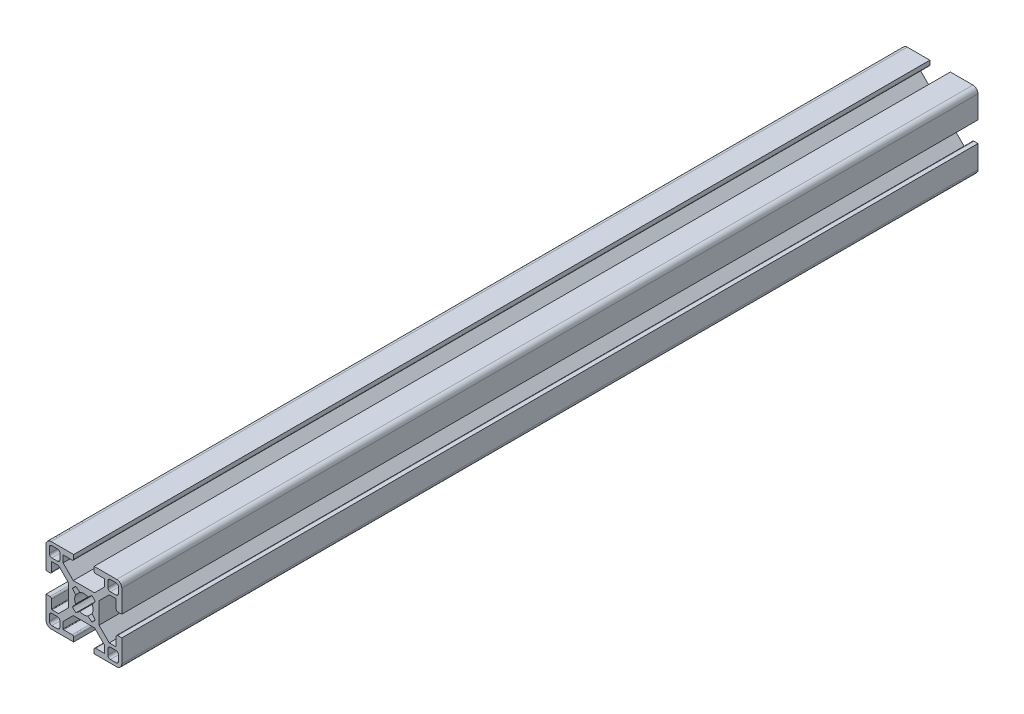
from build123d import *

# Parameters (mm, degrees)
BOSCH_REXROTH_DIMENSION_30_8MM_SLOTS_3_DEPTH = 339


with BuildPart() as part:
    # Sketch1 → Bosch rexroth dimension 30 (8mm slots) 30X30(7) (new body)
    with BuildSketch(Plane(origin=(0, 15, 339), x_dir=(1, 0, 0), z_dir=(0, 0, -1))):
        with BuildLine():
            Line((6.00446543, 4.204465866), (6.00446543, -4.204465866))
            Line((6.00446543, -4.204465866), (10.049999564, -8.25))
            Line((10.049999564, -8.25), (12.59999928, -8.25))
            ThreePointArc((12.59999928, -8.25), (12.741420837, -8.191421273), (12.799999564, -8.049999716))
            Line((12.799999564, -8.049999716), (12.799999564, -4.649999613))
            ThreePointArc((12.799999564, -4.649999613), (12.975735606, -4.225735278), (13.39999994, -4.049999237))
            Line((13.39999994, -4.049999237), (15, -4.049999237))
            Line((15, -4.049999237), (15, -13.000000346))
            ThreePointArc((15, -13.000000346), (14.414213664, -14.414213664), (13.000000346, -15))
            Line((13.000000346, -15), (4.05, -15))
            Line((4.05, -15), (4.05, -13.399999434))
            ThreePointArc((4.05, -13.399999434), (4.225735989, -12.975735226), (4.650000197, -12.799999237))
            Line((4.650000197, -12.799999237), (8.049999924, -12.799999237))
            ThreePointArc((8.049999924, -12.799999237), (8.191421565, -12.741420475), (8.250000327, -12.599998834))
            Line((8.250000327, -12.599998834), (8.250000327, -10.049999237))
            Line((8.250000327, -10.049999237), (4.204466193, -6))
            Line((4.204466193, -6), (-4.204466193, -6))
            Line((-4.204466193, -6), (-8.250000327, -10.049999237))
            Line((-8.250000327, -10.049999237), (-8.250000327, -12.599998834))
            ThreePointArc((-8.250000327, -12.599998834), (-8.191421565, -12.741420475), (-8.049999924, -12.799999237))
            Line((-8.049999924, -12.799999237), (-4.650000197, -12.799999237))
            ThreePointArc((-4.650000197, -12.799999237), (-4.225735989, -12.975735226), (-4.05, -13.399999434))
            Line((-4.05, -13.399999434), (-4.05, -15))
            Line((-4.05, -15), (-13.000000346, -15))
            ThreePointArc((-13.000000346, -15), (-14.414213664, -14.414213664), (-15, -13.000000346))
            Line((-15, -13.000000346), (-15, -4.049999237))
            Line((-15, -4.049999237), (-13.39999994, -4.049999237))
            ThreePointArc((-13.39999994, -4.049999237), (-12.975735606, -4.225735278), (-12.799999564, -4.649999613))
            Line((-12.799999564, -4.649999613), (-12.799999564, -8.049999716))
            ThreePointArc((-12.799999564, -8.049999716), (-12.741420837, -8.191421273), (-12.59999928, -8.25))
            Line((-12.59999928, -8.25), (-10.049999564, -8.25))
            Line((-10.049999564, -8.25), (-6.00446543, -4.204465866))
            Line((-6.00446543, -4.204465866), (-6.00446543, 4.204465866))
            Line((-6.00446543, 4.204465866), (-10.049999564, 8.25))
            Line((-10.049999564, 8.25), (-12.59999928, 8.25))
            ThreePointArc((-12.59999928, 8.25), (-12.741420837, 8.191421273), (-12.799999564, 8.049999716))
            Line((-12.799999564, 8.049999716), (-12.799999564, 4.649999613))
            ThreePointArc((-12.799999564, 4.649999613), (-12.975735606, 4.225735278), (-13.39999994, 4.049999237))
            Line((-13.39999994, 4.049999237), (-15, 4.049999237))
            Line((-15, 4.049999237), (-15, 13.000000346))
            ThreePointArc((-15, 13.000000346), (-14.414213664, 14.414213664), (-13.000000346, 15))
            Line((-13.000000346, 15), (-4.05, 15))
            Line((-4.05, 15), (-4.05, 13.399999434))
            ThreePointArc((-4.05, 13.399999434), (-4.225735989, 12.975735226), (-4.650000197, 12.799999237))
            Line((-4.650000197, 12.799999237), (-8.049999924, 12.799999237))
            ThreePointArc((-8.049999924, 12.799999237), (-8.191421565, 12.741420475), (-8.250000327, 12.599998834))
            Line((-8.250000327, 12.599998834), (-8.250000327, 10.049999237))
            Line((-8.250000327, 10.049999237), (-4.204466193, 6))
            Line((-4.204466193, 6), (4.204466193, 6))
            Line((4.204466193, 6), (8.250000327, 10.049999237))
            Line((8.250000327, 10.049999237), (8.250000327, 12.599998834))
            ThreePointArc((8.250000327, 12.599998834), (8.191421565, 12.741420475), (8.049999924, 12.799999237))
            Line((8.049999924, 12.799999237), (4.650000197, 12.799999237))
            ThreePointArc((4.650000197, 12.799999237), (4.225735989, 12.975735226), (4.05, 13.399999434))
            Line((4.05, 13.399999434), (4.05, 15))
            Line((4.05, 15), (13.000000346, 15))
            ThreePointArc((13.000000346, 15), (14.414213664, 14.414213664), (15, 13.000000346))
            Line((15, 13.000000346), (15, 4.049999237))
            Line((15, 4.049999237), (13.39999994, 4.049999237))
            ThreePointArc((13.39999994, 4.049999237), (12.975735606, 4.225735278), (12.799999564, 4.649999613))
            Line((12.799999564, 4.649999613), (12.799999564, 8.049999716))
            ThreePointArc((12.799999564, 8.049999716), (12.741420837, 8.191421273), (12.59999928, 8.25))
            Line((12.59999928, 8.25), (10.049999564, 8.25))
            Line((10.049999564, 8.25), (6.00446543, 4.204465866))
        make_face()
        with BuildLine():
            Line((13.70000109, 12.700000408), (13.70000109, 10.499999626))
            ThreePointArc((13.70000109, 10.499999626), (13.407107874, 9.792892851), (12.7000011, 9.499999635))
            Line((12.7000011, 9.499999635), (10.500000318, 9.499999635))
            ThreePointArc((10.500000318, 9.499999635), (9.792893543, 9.792892851), (9.500000327, 10.499999626))
            Line((9.500000327, 10.499999626), (9.500000327, 12.700000408))
            ThreePointArc((9.500000327, 12.700000408), (9.792893543, 13.407107182), (10.500000318, 13.700000398))
            Line((10.500000318, 13.700000398), (12.7000011, 13.700000398))
            ThreePointArc((12.7000011, 13.700000398), (13.407107874, 13.407107182), (13.70000109, 12.700000408))
        make_face(mode=Mode.SUBTRACT)
        with BuildLine():
            Line((3.135929412, 4.518400903), (1.600129524, 3.280561767))
            ThreePointArc((1.600129524, 3.280561767), (0, 3.65), (-1.600129524, 3.280561767))
            Line((-1.600129524, 3.280561767), (-3.135929412, 4.518400903))
            ThreePointArc((-3.135929412, 4.518400903), (-3.881002259, 3.897155561), (-4.505336892, 3.154669473))
            Line((-4.505336892, 3.154669473), (-3.280561732, 1.600129597))
            ThreePointArc((-3.280561732, 1.600129597), (-3.65, 0), (-3.280561732, -1.600129597))
            Line((-3.280561732, -1.600129597), (-4.505336892, -3.154669473))
            ThreePointArc((-4.505336892, -3.154669473), (-3.881002259, -3.897155561), (-3.135929412, -4.518400903))
            Line((-3.135929412, -4.518400903), (-1.600129524, -3.280561767))
            ThreePointArc((-1.600129524, -3.280561767), (0, -3.65), (1.600129524, -3.280561767))
            Line((1.600129524, -3.280561767), (3.135929412, -4.518400903))
            ThreePointArc((3.135929412, -4.518400903), (3.881002259, -3.897155561), (4.505336892, -3.154669473))
            Line((4.505336892, -3.154669473), (3.280561732, -1.600129597))
            ThreePointArc((3.280561732, -1.600129597), (3.65, 0), (3.280561732, 1.600129597))
            Line((3.280561732, 1.600129597), (4.505336892, 3.154669473))
            ThreePointArc((4.505336892, 3.154669473), (3.881002259, 3.897155561), (3.135929412, 4.518400903))
        make_face(mode=Mode.SUBTRACT)
        with BuildLine():
            Line((-13.70000109, -12.700000408), (-13.70000109, -10.499999626))
            ThreePointArc((-13.70000109, -10.499999626), (-13.407107874, -9.792892851), (-12.7000011, -9.499999635))
            Line((-12.7000011, -9.499999635), (-10.500000318, -9.499999635))
            ThreePointArc((-10.500000318, -9.499999635), (-9.792893543, -9.792892851), (-9.500000327, -10.499999626))
            Line((-9.500000327, -10.499999626), (-9.500000327, -12.700000408))
            ThreePointArc((-9.500000327, -12.700000408), (-9.792893543, -13.407107182), (-10.500000318, -13.700000398))
            Line((-10.500000318, -13.700000398), (-12.7000011, -13.700000398))
            ThreePointArc((-12.7000011, -13.700000398), (-13.407107874, -13.407107182), (-13.70000109, -12.700000408))
        make_face(mode=Mode.SUBTRACT)
        with BuildLine():
            Line((10.500000318, -13.700000398), (12.7000011, -13.700000398))
            ThreePointArc((12.7000011, -13.700000398), (13.407107874, -13.407107182), (13.70000109, -12.700000408))
            Line((13.70000109, -12.700000408), (13.70000109, -10.499999626))
            ThreePointArc((13.70000109, -10.499999626), (13.407107874, -9.792892851), (12.7000011, -9.499999635))
            Line((12.7000011, -9.499999635), (10.500000318, -9.499999635))
            ThreePointArc((10.500000318, -9.499999635), (9.792893543, -9.792892851), (9.500000327, -10.499999626))
            Line((9.500000327, -10.499999626), (9.500000327, -12.700000408))
            ThreePointArc((9.500000327, -12.700000408), (9.792893543, -13.407107182), (10.500000318, -13.700000398))
        make_face(mode=Mode.SUBTRACT)
        with BuildLine():
            Line((-10.500000318, 13.700000398), (-12.7000011, 13.700000398))
            ThreePointArc((-12.7000011, 13.700000398), (-13.407107874, 13.407107182), (-13.70000109, 12.700000408))
            Line((-13.70000109, 12.700000408), (-13.70000109, 10.499999626))
            ThreePointArc((-13.70000109, 10.499999626), (-13.407107874, 9.792892851), (-12.7000011, 9.499999635))
            Line((-12.7000011, 9.499999635), (-10.500000318, 9.499999635))
            ThreePointArc((-10.500000318, 9.499999635), (-9.792893543, 9.792892851), (-9.500000327, 10.499999626))
            Line((-9.500000327, 10.499999626), (-9.500000327, 12.700000408))
            ThreePointArc((-9.500000327, 12.700000408), (-9.792893543, 13.407107182), (-10.500000318, 13.700000398))
        make_face(mode=Mode.SUBTRACT)
    extrude(amount=BOSCH_REXROTH_DIMENSION_30_8MM_SLOTS_3_DEPTH)


solid = part.part
